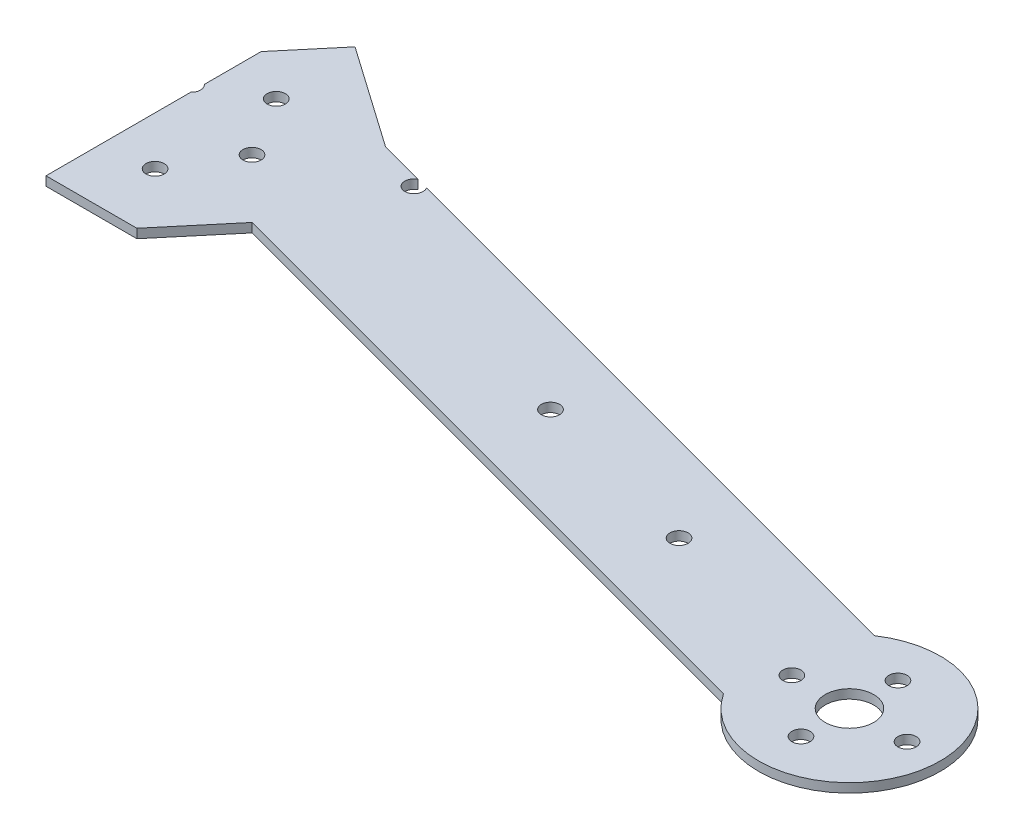
from build123d import *

# Parameters (mm, degrees)
SKETCH2_R           = 1.5
SKETCH2_R_2         = 4
BOSS_EXTRUDE1_DEPTH = 1.5
SKETCH6_R           = 1.5
CUT_EXTRUDE1_DEPTH  = 1.5
SKETCH7_R           = 1.5
CUT_EXTRUDE2_DEPTH  = 1.5


with BuildPart() as part:
    # Sketch2 → Boss-Extrude1 (new body)
    with BuildSketch(Plane(origin=(0, 0, 0), x_dir=(1, 0, 0), z_dir=(0, 1, 0))):
        with BuildLine():
            Line((0, -46.879161521), (0, -70.761127532))
            Line((0, -70.761127532), (15, -70.761127532))
            Line((15, -70.761127532), (23.677632731, -60.41952755))
            Line((23.677632731, -60.41952755), (129.929473623, -88.889622511))
            ThreePointArc((129.929473623, -88.889622511), (157.136079306, -83.55030532), (134.097880355, -68.124706791))
            Line((134.097880355, -68.124706791), (23.863280614, -38.592955603))
            Line((23.863280614, -38.592955603), (7.070663707, -26.834638658))
            Line((7.070663707, -26.834638658), (0, -35.261127532))
            Line((0, -35.261127532), (0, -44.643093543))
            ThreePointArc((0, -44.643093543), (0.5, -45.761127532), (0, -46.879161521))
        make_face()
        with Locations(Location((8, -40.761127532, 0), (0, 0, 90))):
            Circle(SKETCH2_R, mode=Mode.SUBTRACT)
        with Locations(Location((14, -50.761127532, 0), (0, 0, 90))):
            Circle(SKETCH2_R, mode=Mode.SUBTRACT)
        with Locations(Location((8, -60.761127532, 0), (0, 0, 90))):
            Circle(SKETCH2_R, mode=Mode.SUBTRACT)
        with Locations(Location((142.429473623, -80.598060535, 0), (0, 0, 90))):
            Circle(SKETCH2_R_2, mode=Mode.SUBTRACT)
        with Locations(Location((142.429473623, -72.598060535, 0), (0, 0, 270))):
            Circle(SKETCH2_R, mode=Mode.SUBTRACT)
        with Locations(Location((151.929473623, -80.598060535, 0), (0, 0, 270))):
            Circle(SKETCH2_R, mode=Mode.SUBTRACT)
        with Locations(Location((142.429473623, -88.598060535, 0), (0, 0, 270))):
            Circle(SKETCH2_R, mode=Mode.SUBTRACT)
        with Locations(Location((132.929473623, -80.598060535, 0), (0, 0, 270))):
            Circle(SKETCH2_R, mode=Mode.SUBTRACT)
    extrude(amount=BOSS_EXTRUDE1_DEPTH)

    # Sketch6 → Cut-Extrude1 (cut)
    with BuildSketch(Plane(origin=(0, 1.5, 0), x_dir=(1, 0, 0), z_dir=(0, 1, 0))):
        with Locations((31.86, -41.901127532)):
            Circle(SKETCH6_R)
    extrude(amount=-CUT_EXTRUDE1_DEPTH, mode=Mode.SUBTRACT)

    # Sketch7 → Cut-Extrude2 (cut)
    with BuildSketch(Plane(origin=(0, 1.5, 0), x_dir=(1, 0, 0), z_dir=(0, 1, 0))):
        with Locations(Location((75.035984993, -62.543404895, 0), (0, 0, 270))):
            Circle(SKETCH7_R)
        with Locations(Location((104.014122572, -70.306622169, 0), (0, 0, 270))):
            Circle(SKETCH7_R)
    extrude(amount=-CUT_EXTRUDE2_DEPTH, mode=Mode.SUBTRACT)


solid = part.part
